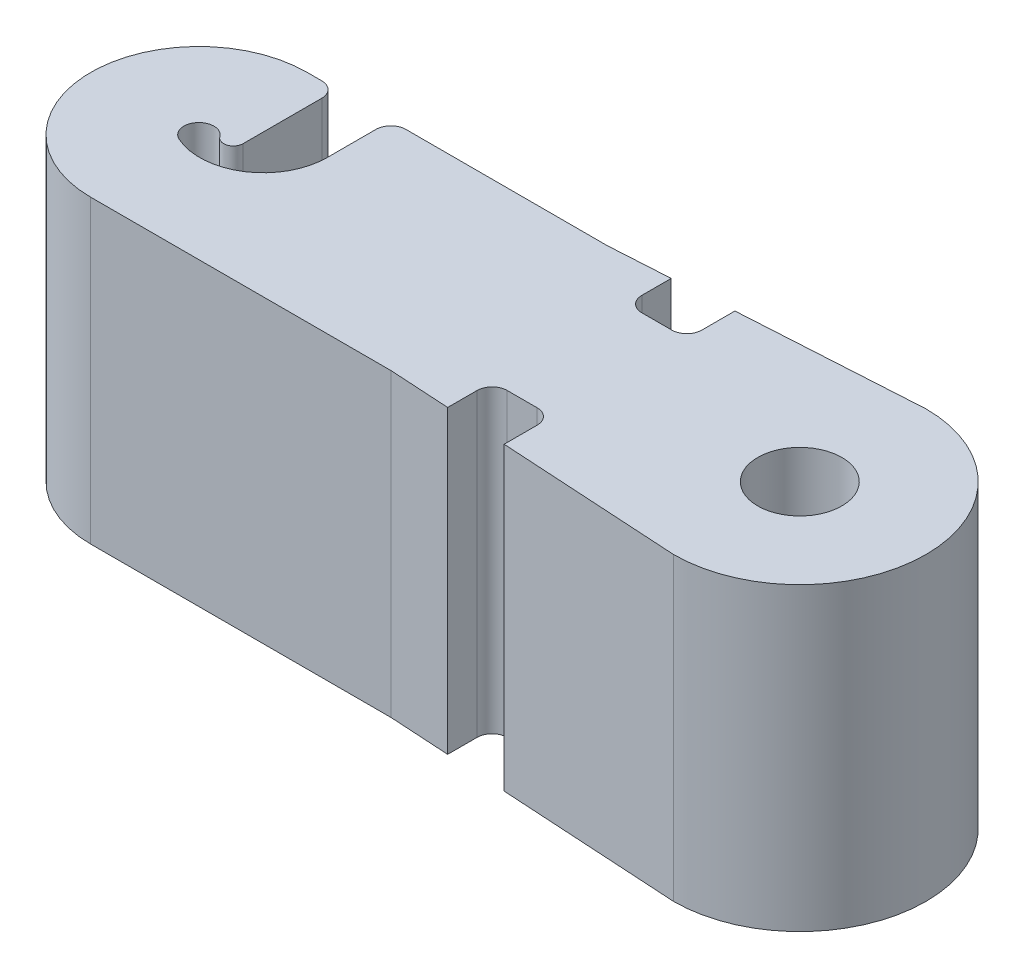
from build123d import *

# Parameters (mm, degrees)
BOSS_EXTRUDE1_DEPTH = 2.5
SKETCH4_R           = 0.35
THROUGH_HOLES_DEPTH = 7.493265742
FILLET1_R           = 0.125


with BuildPart() as part:
    # Sketch3 → Boss-Extrude1 (new body)
    with BuildSketch(Plane(origin=(0, 0, 0), x_dir=(1, 0, 0), z_dir=(0, 1, 0))):
        with BuildLine():
            Line((-2.5, 0.9), (-2, 0.93))
            Line((-2, 0.93), (-2, 0.56))
            Line((-2, 0.56), (-1.5, 0.56))
            Line((-1.5, 0.56), (-1.5, 0.96))
            Line((-1.5, 0.96), (0, 1.05))
            ThreePointArc((0, 1.05), (1.05, 0), (0, -1.05))
            Line((0, -1.05), (-1.5, -0.96))
            Line((-1.5, -0.96), (-1.5, -0.56))
            Line((-1.5, -0.56), (-2, -0.56))
            Line((-2, -0.56), (-2, -0.93))
            Line((-2, -0.93), (-2.5, -0.9))
            Line((-2.5, -0.9), (-5, -0.9))
            ThreePointArc((-5, -0.9), (-5.9, 0), (-5, 0.9))
            Line((-5, 0.9), (-2.5, 0.9))
        make_face()
    extrude(amount=BOSS_EXTRUDE1_DEPTH)

    # Sketch4 → Through Holes (cut, through all)
    with BuildSketch(Plane(origin=(0, 2.5, 0), x_dir=(1, 0, 0), z_dir=(0, 1, 0))):
        with Locations(Location((0, 0, 0), (0, 0, 270))):
            Circle(SKETCH4_R)
        with BuildLine():
            Line((-4.752153945, 0.9), (-4.302153945, 0.9))
            Line((-4.302153945, 0.9), (-4.302153945, 0.369444444))
            ThreePointArc((-4.302153945, 0.369444444), (-4.545154537, -0.076426995), (-5.05156214, -0.113869863))
            ThreePointArc((-5.05156214, -0.113869863), (-5.096567334, 0.079370965), (-4.898269291, 0.072635135))
            ThreePointArc((-4.898269291, 0.072635135), (-4.808133169, 0.042729378), (-4.752153945, 0.119444444))
            Line((-4.752153945, 0.119444444), (-4.752153945, 0.9))
        make_face()
    extrude(amount=-THROUGH_HOLES_DEPTH, mode=Mode.SUBTRACT)

    # Fillet1
    fillet1_edges = [part.edges().sort_by_distance(p)[0] for p in [
        (-2, 1.25, 0.56),
        (-1.5, 1.25, 0.56),
        (-1.5, 1.25, -0.56),
        (-2, 1.25, -0.56),
        (-4.752153945, 1.25, -0.9),
        (-4.302153945, 1.25, -0.9),
    ]]
    fillet(fillet1_edges, radius=FILLET1_R)


solid = part.part
